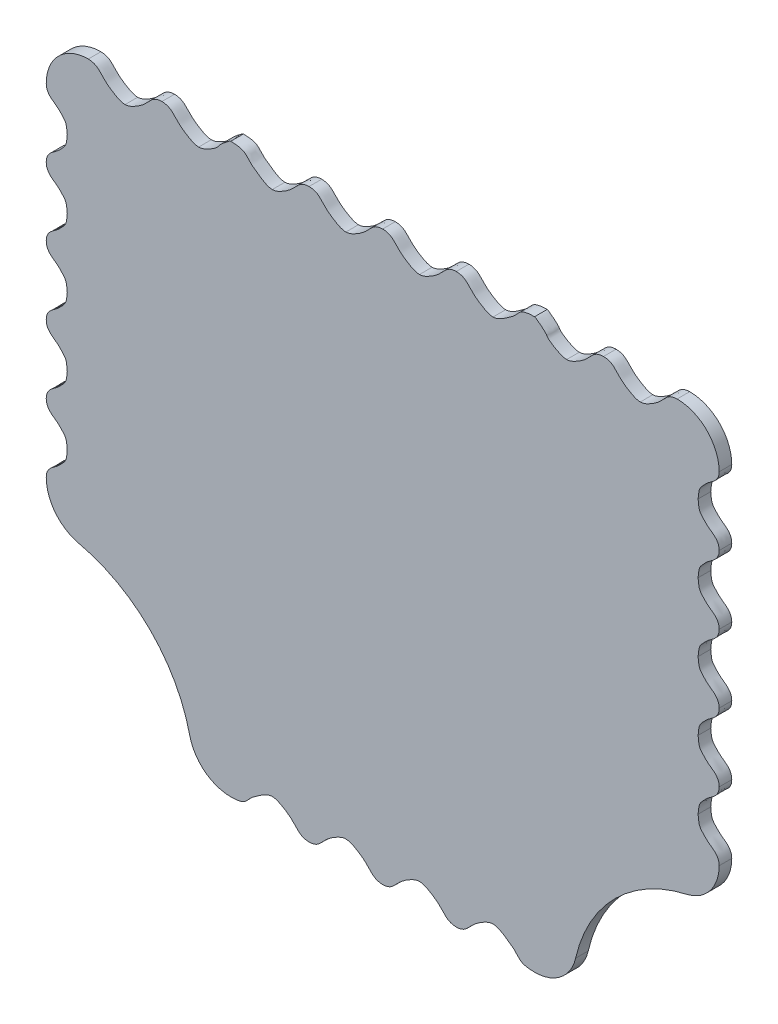
from build123d import *

# Parameters (mm, degrees)
BOSS_EXTRUDE1_DEPTH = 3


with BuildPart() as part:
    # Sketch1 → Boss-Extrude1 (new body)
    with BuildSketch(Plane.XY):
        with BuildLine():
            ThreePointArc((-72.222222222, -33.375138493), (-55.251262658, -42.751262658), (-45.875138493, -59.722222222))
            ThreePointArc((-45.875138493, -59.722222222), (-42.361273708, -65.3173596), (-36.125178063, -67.5))
            add(Edge.make_bspline(
                [(-36.125178063, -67.5), (-33.318820863, -67.469450173), (-31.351367688, -65.264439198), (-30.783347683, -64.925562284), (-27.763465262, -62.457048226), (-26.25, -62.5)],
                knots=[0, 0, 0, 0, 0.090048414, 0.292197045, 1, 1, 1, 1], degree=3))
            add(Edge.make_bspline(
                [(-17.5, -67.5), (-19.037838621, -67.469450173), (-21.376336716, -65.264439198), (-21.403305799, -64.925562284), (-24.736534738, -62.457048226), (-26.25, -62.5)],
                knots=[0, 0, 0, 0, 0.090048414, 0.292197045, 1, 1, 1, 1], degree=3))
            add(Edge.make_bspline(
                [(-17.5, -67.5), (-15.962161379, -67.469450173), (-13.623663284, -65.264439198), (-13.596694201, -64.925562284), (-10.263465262, -62.457048226), (-8.75, -62.5)],
                knots=[0, 0, 0, 0, 0.090048414, 0.292197045, 1, 1, 1, 1], degree=3))
            add(Edge.make_bspline(
                [(0, -67.5), (-1.537838621, -67.469450173), (-3.876336716, -65.264439198), (-3.903305799, -64.925562284), (-7.236534738, -62.457048226), (-8.75, -62.5)],
                knots=[0, 0, 0, 0, 0.090048414, 0.292197045, 1, 1, 1, 1], degree=3))
            add(Edge.make_bspline(
                [(0, -67.5), (1.537838621, -67.469450173), (3.876336716, -65.264439198), (3.903305799, -64.925562284), (7.236534738, -62.457048226), (8.75, -62.5)],
                knots=[0, 0, 0, 0, 0.090048414, 0.292197045, 1, 1, 1, 1], degree=3))
            add(Edge.make_bspline(
                [(17.5, -67.5), (15.962161379, -67.469450173), (13.623663284, -65.264439198), (13.596694201, -64.925562284), (10.263465262, -62.457048226), (8.75, -62.5)],
                knots=[0, 0, 0, 0, 0.090048414, 0.292197045, 1, 1, 1, 1], degree=3))
            add(Edge.make_bspline(
                [(17.5, -67.5), (19.037838621, -67.469450173), (21.376336716, -65.264439198), (21.403305799, -64.925562284), (24.736534738, -62.457048226), (26.25, -62.5)],
                knots=[0, 0, 0, 0, 0.090048414, 0.292197045, 1, 1, 1, 1], degree=3))
            add(Edge.make_bspline(
                [(36.125178063, -67.5), (33.318820863, -67.469450173), (31.351367688, -65.264439198), (30.783347683, -64.925562284), (27.763465262, -62.457048226), (26.25, -62.5)],
                knots=[0, 0, 0, 0, 0.090048414, 0.292197045, 1, 1, 1, 1], degree=3))
            ThreePointArc((36.125178063, -67.5), (42.361273708, -65.3173596), (45.875138493, -59.722222222))
            ThreePointArc((45.875138493, -59.722222222), (55.251262658, -42.751262658), (72.222222222, -33.375138493))
            ThreePointArc((72.222222222, -33.375138493), (77.8173596, -29.861273708), (80, -23.625178063))
            add(Edge.make_bspline(
                [(80, -23.625178063), (80.032803847, -22.065393972), (78.08422658, -20.486646458), (77.30092406, -20.039230725), (75.293367208, -17.941482796), (75.191920372, -17.745673283), (75, -15.512178063)],
                knots=[0, 0, 0, 0, 0.224601048, 0.419775482, 0.497315377, 1, 1, 1, 1], degree=3))
            add(Edge.make_bspline(
                [(80, -7.399178063), (80.032803847, -8.958962154), (78.08422658, -10.537709668), (77.30092406, -10.985125401), (75.293367208, -13.08287333), (75.191920372, -13.278682843), (75, -15.512178063)],
                knots=[0, 0, 0, 0, 0.224601048, 0.419775482, 0.497315377, 1, 1, 1, 1], degree=3))
            add(Edge.make_bspline(
                [(80, -7.399178063), (80.032803847, -5.839393972), (78.08422658, -4.254983183), (77.30092406, -3.809384172), (75.293367208, -1.711134173), (75.191920372, -1.515673283), (75, 0.717821937)],
                knots=[0, 0, 0, 0, 0.224601048, 0.419775482, 0.497315377, 1, 1, 1, 1], degree=3))
            add(Edge.make_bspline(
                [(80, 8.830821937), (80.032803847, 7.271037846), (78.08422658, 5.692290332), (77.30092406, 5.244874599), (75.293367208, 3.14712667), (75.191920372, 2.951317157), (75, 0.717821937)],
                knots=[0, 0, 0, 0, 0.224601048, 0.419775482, 0.497315377, 1, 1, 1, 1], degree=3))
            add(Edge.make_bspline(
                [(80, 8.830821937), (80.032803847, 10.390606028), (78.08422658, 11.975016817), (77.30092406, 12.420615828), (75.293367208, 14.518865827), (75.191920372, 14.714326717), (75, 16.947821937)],
                knots=[0, 0, 0, 0, 0.224601048, 0.419775482, 0.497315377, 1, 1, 1, 1], degree=3))
            add(Edge.make_bspline(
                [(80, 25.060821937), (80.032803847, 23.501037846), (78.08422658, 21.922290332), (77.30092406, 21.474874599), (75.293367208, 19.37712667), (75.191920372, 19.181317157), (75, 16.947821937)],
                knots=[0, 0, 0, 0, 0.224601048, 0.419775482, 0.497315377, 1, 1, 1, 1], degree=3))
            add(Edge.make_bspline(
                [(80, 25.060821937), (80.032803847, 26.620606028), (78.08422658, 28.205016817), (77.30092406, 28.650615828), (75.293367208, 30.748865827), (75.191920372, 30.944326717), (75, 33.177821937)],
                knots=[0, 0, 0, 0, 0.224601048, 0.419775482, 0.497315377, 1, 1, 1, 1], degree=3))
            add(Edge.make_bspline(
                [(80, 41.290821937), (80.032803847, 39.731037846), (78.08422658, 38.152290332), (77.30092406, 37.704874599), (75.293367208, 35.60712667), (75.191920372, 35.411317157), (75, 33.177821937)],
                knots=[0, 0, 0, 0, 0.224601048, 0.419775482, 0.497315377, 1, 1, 1, 1], degree=3))
            add(Edge.make_bspline(
                [(80, 41.290821937), (80.032803847, 42.850606028), (78.08422658, 44.429353542), (77.30092406, 44.876769275), (75.293367208, 46.974517204), (75.191920372, 47.170326717), (75, 49.403821937)],
                knots=[0, 0, 0, 0, 0.224601048, 0.419775482, 0.497315377, 1, 1, 1, 1], degree=3))
            add(Edge.make_bspline(
                [(80, 57.5), (80.032803847, 55.940215909), (78.08422658, 54.385285205), (77.30092406, 53.930229281), (75.293367208, 51.8345928), (75.191920372, 51.637317157), (75, 49.403821937)],
                knots=[0, 0, 0, 0, 0.224601048, 0.419775482, 0.497315377, 1, 1, 1, 1], degree=3))
            ThreePointArc((80, 57.5), (77.071067812, 64.571067812), (70, 67.5))
            add(Edge.make_bspline(
                [(70, 67.5), (68.462161379, 67.469450173), (66.123663284, 65.264439198), (66.096694201, 64.925562284), (62.763465262, 62.457048226), (61.25, 62.5)],
                knots=[0, 0, 0, 0, 0.090048414, 0.292197045, 1, 1, 1, 1], degree=3))
            add(Edge.make_bspline(
                [(52.5, 67.5), (54.037838621, 67.469450173), (56.376336716, 65.264439198), (56.403305799, 64.925562284), (59.736534738, 62.457048226), (61.25, 62.5)],
                knots=[0, 0, 0, 0, 0.090048414, 0.292197045, 1, 1, 1, 1], degree=3))
            add(Edge.make_bspline(
                [(52.5, 67.5), (50.962161379, 67.469450173), (48.623663284, 65.264439198), (48.596694201, 64.925562284), (45.263465262, 62.457048226), (43.75, 62.5)],
                knots=[0, 0, 0, 0, 0.090048414, 0.292197045, 1, 1, 1, 1], degree=3))
            add(Edge.make_bspline(
                [(36.125178063, 67.5), (36.394498104, 67.469450173), (39.10404112, 65.264439198), (38.58995928, 64.925562284), (42.236534738, 62.457048226), (43.75, 62.5)],
                knots=[0, 0, 0, 0, 0.090048414, 0.292197045, 1, 1, 1, 1], degree=3))
            add(Edge.make_bspline(
                [(36.125178063, 67.5), (33.318820863, 67.469450173), (31.351367688, 65.264439198), (30.783347683, 64.925562284), (27.763465262, 62.457048226), (26.25, 62.5)],
                knots=[0, 0, 0, 0, 0.090048414, 0.292197045, 1, 1, 1, 1], degree=3))
            add(Edge.make_bspline(
                [(17.5, 67.5), (19.037838621, 67.469450173), (21.376336716, 65.264439198), (21.403305799, 64.925562284), (24.736534738, 62.457048226), (26.25, 62.5)],
                knots=[0, 0, 0, 0, 0.090048414, 0.292197045, 1, 1, 1, 1], degree=3))
            add(Edge.make_bspline(
                [(17.5, 67.5), (15.962161379, 67.469450173), (13.623663284, 65.264439198), (13.596694201, 64.925562284), (10.263465262, 62.457048226), (8.75, 62.5)],
                knots=[0, 0, 0, 0, 0.090048414, 0.292197045, 1, 1, 1, 1], degree=3))
            add(Edge.make_bspline(
                [(0, 67.5), (1.537838621, 67.469450173), (3.876336716, 65.264439198), (3.903305799, 64.925562284), (7.236534738, 62.457048226), (8.75, 62.5)],
                knots=[0, 0, 0, 0, 0.090048414, 0.292197045, 1, 1, 1, 1], degree=3))
            add(Edge.make_bspline(
                [(0, 67.5), (-1.537838621, 67.469450173), (-3.876336716, 65.264439198), (-3.903305799, 64.925562284), (-7.236534738, 62.457048226), (-8.75, 62.5)],
                knots=[0, 0, 0, 0, 0.090048414, 0.292197045, 1, 1, 1, 1], degree=3))
            add(Edge.make_bspline(
                [(-17.5, 67.5), (-15.962161379, 67.469450173), (-13.623663284, 65.264439198), (-13.596694201, 64.925562284), (-10.263465262, 62.457048226), (-8.75, 62.5)],
                knots=[0, 0, 0, 0, 0.090048414, 0.292197045, 1, 1, 1, 1], degree=3))
            add(Edge.make_bspline(
                [(-17.5, 67.5), (-19.037838621, 67.469450173), (-21.376336716, 65.264439198), (-21.403305799, 64.925562284), (-24.736534738, 62.457048226), (-26.25, 62.5)],
                knots=[0, 0, 0, 0, 0.090048414, 0.292197045, 1, 1, 1, 1], degree=3))
            add(Edge.make_bspline(
                [(-36.125178063, 67.5), (-33.318820863, 67.469450173), (-31.351367688, 65.264439198), (-30.783347683, 64.925562284), (-27.763465262, 62.457048226), (-26.25, 62.5)],
                knots=[0, 0, 0, 0, 0.090048414, 0.292197045, 1, 1, 1, 1], degree=3))
            add(Edge.make_bspline(
                [(-36.125178063, 67.5), (-36.394498104, 67.469450173), (-39.10404112, 65.264439198), (-38.58995928, 64.925562284), (-42.236534738, 62.457048226), (-43.75, 62.5)],
                knots=[0, 0, 0, 0, 0.090048414, 0.292197045, 1, 1, 1, 1], degree=3))
            add(Edge.make_bspline(
                [(-52.5, 67.5), (-50.962161379, 67.469450173), (-48.623663284, 65.264439198), (-48.596694201, 64.925562284), (-45.263465262, 62.457048226), (-43.75, 62.5)],
                knots=[0, 0, 0, 0, 0.090048414, 0.292197045, 1, 1, 1, 1], degree=3))
            add(Edge.make_bspline(
                [(-52.5, 67.5), (-54.037838621, 67.469450173), (-56.376336716, 65.264439198), (-56.403305799, 64.925562284), (-59.736534738, 62.457048226), (-61.25, 62.5)],
                knots=[0, 0, 0, 0, 0.090048414, 0.292197045, 1, 1, 1, 1], degree=3))
            add(Edge.make_bspline(
                [(-70, 67.5), (-68.462161379, 67.469450173), (-66.123663284, 65.264439198), (-66.096694201, 64.925562284), (-62.763465262, 62.457048226), (-61.25, 62.5)],
                knots=[0, 0, 0, 0, 0.090048414, 0.292197045, 1, 1, 1, 1], degree=3))
            ThreePointArc((-70, 67.5), (-77.071067812, 64.571067812), (-80, 57.5))
            add(Edge.make_bspline(
                [(-80, 57.5), (-80.032803847, 55.940215909), (-78.08422658, 54.385285205), (-77.30092406, 53.930229281), (-75.293367208, 51.8345928), (-75.191920372, 51.637317157), (-75, 49.403821937)],
                knots=[0, 0, 0, 0, 0.224601048, 0.419775482, 0.497315377, 1, 1, 1, 1], degree=3))
            add(Edge.make_bspline(
                [(-80, 41.290821937), (-80.032803847, 42.850606028), (-78.08422658, 44.429353542), (-77.30092406, 44.876769275), (-75.293367208, 46.974517204), (-75.191920372, 47.170326717), (-75, 49.403821937)],
                knots=[0, 0, 0, 0, 0.224601048, 0.419775482, 0.497315377, 1, 1, 1, 1], degree=3))
            add(Edge.make_bspline(
                [(-80, 41.290821937), (-80.032803847, 39.731037846), (-78.08422658, 38.152290332), (-77.30092406, 37.704874599), (-75.293367208, 35.60712667), (-75.191920372, 35.411317157), (-75, 33.177821937)],
                knots=[0, 0, 0, 0, 0.224601048, 0.419775482, 0.497315377, 1, 1, 1, 1], degree=3))
            add(Edge.make_bspline(
                [(-80, 25.060821937), (-80.032803847, 26.620606028), (-78.08422658, 28.205016817), (-77.30092406, 28.650615828), (-75.293367208, 30.748865827), (-75.191920372, 30.944326717), (-75, 33.177821937)],
                knots=[0, 0, 0, 0, 0.224601048, 0.419775482, 0.497315377, 1, 1, 1, 1], degree=3))
            add(Edge.make_bspline(
                [(-80, 25.060821937), (-80.032803847, 23.501037846), (-78.08422658, 21.922290332), (-77.30092406, 21.474874599), (-75.293367208, 19.37712667), (-75.191920372, 19.181317157), (-75, 16.947821937)],
                knots=[0, 0, 0, 0, 0.224601048, 0.419775482, 0.497315377, 1, 1, 1, 1], degree=3))
            add(Edge.make_bspline(
                [(-80, 8.830821937), (-80.032803847, 10.390606028), (-78.08422658, 11.975016817), (-77.30092406, 12.420615828), (-75.293367208, 14.518865827), (-75.191920372, 14.714326717), (-75, 16.947821937)],
                knots=[0, 0, 0, 0, 0.224601048, 0.419775482, 0.497315377, 1, 1, 1, 1], degree=3))
            add(Edge.make_bspline(
                [(-80, 8.830821937), (-80.032803847, 7.271037846), (-78.08422658, 5.692290332), (-77.30092406, 5.244874599), (-75.293367208, 3.14712667), (-75.191920372, 2.951317157), (-75, 0.717821937)],
                knots=[0, 0, 0, 0, 0.224601048, 0.419775482, 0.497315377, 1, 1, 1, 1], degree=3))
            add(Edge.make_bspline(
                [(-80, -7.399178063), (-80.032803847, -5.839393972), (-78.08422658, -4.254983183), (-77.30092406, -3.809384172), (-75.293367208, -1.711134173), (-75.191920372, -1.515673283), (-75, 0.717821937)],
                knots=[0, 0, 0, 0, 0.224601048, 0.419775482, 0.497315377, 1, 1, 1, 1], degree=3))
            add(Edge.make_bspline(
                [(-80, -7.399178063), (-80.032803847, -8.958962154), (-78.08422658, -10.537709668), (-77.30092406, -10.985125401), (-75.293367208, -13.08287333), (-75.191920372, -13.278682843), (-75, -15.512178063)],
                knots=[0, 0, 0, 0, 0.224601048, 0.419775482, 0.497315377, 1, 1, 1, 1], degree=3))
            add(Edge.make_bspline(
                [(-80, -23.625178063), (-80.032803847, -22.065393972), (-78.08422658, -20.486646458), (-77.30092406, -20.039230725), (-75.293367208, -17.941482796), (-75.191920372, -17.745673283), (-75, -15.512178063)],
                knots=[0, 0, 0, 0, 0.224601048, 0.419775482, 0.497315377, 1, 1, 1, 1], degree=3))
            ThreePointArc((-80, -23.625178063), (-77.8173596, -29.861273708), (-72.222222222, -33.375138493))
        make_face()
    extrude(amount=BOSS_EXTRUDE1_DEPTH)


solid = part.part
